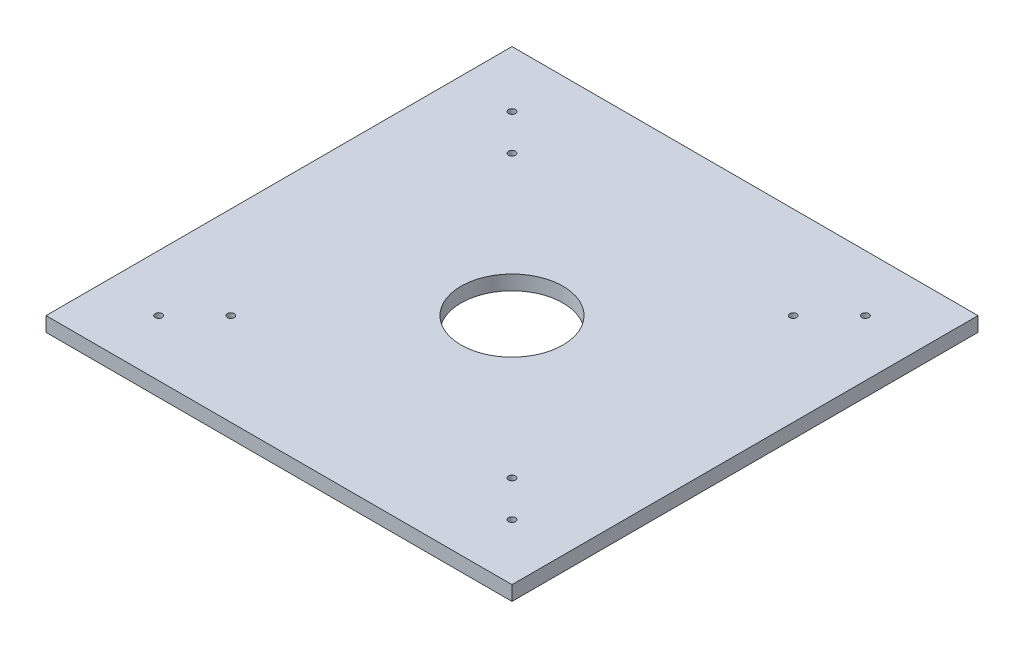
from build123d import *

# Parameters (mm, degrees)
SKETCH1_W           = 160
SKETCH1_H           = 160
SKETCH1_R           = 1.2
SKETCH1_R_2         = 17.5
BOSS_EXTRUDE1_DEPTH = 5


with BuildPart() as part:
    # Sketch1 → Boss-Extrude1 (new body)
    with BuildSketch(Plane(origin=(0, 0, 0), x_dir=(1, 0, 0), z_dir=(0, 1, 0))):
        Rectangle(SKETCH1_W, SKETCH1_H)
        with Locations(Location((-60.664206642, 60.664206642, 0), (0, 0, 270))):
            Circle(SKETCH1_R, mode=Mode.SUBTRACT)
        with Locations(Location((-48.279552135, 48.279552135, 0), (0, 0, 270))):
            Circle(SKETCH1_R, mode=Mode.SUBTRACT)
        with Locations(Location((48.279552135, 48.279552135, 0), (0, 0, 90))):
            Circle(SKETCH1_R, mode=Mode.SUBTRACT)
        with Locations(Location((60.664206642, 60.664206642, 0), (0, 0, 90))):
            Circle(SKETCH1_R, mode=Mode.SUBTRACT)
        with Locations(Location((60.664206642, -60.664206642, 0), (0, 0, 270))):
            Circle(SKETCH1_R, mode=Mode.SUBTRACT)
        with Locations(Location((48.279552135, -48.279552135, 0), (0, 0, 270))):
            Circle(SKETCH1_R, mode=Mode.SUBTRACT)
        with Locations(Location((-48.279552135, -48.279552135, 0), (0, 0, 90))):
            Circle(SKETCH1_R, mode=Mode.SUBTRACT)
        with Locations(Location((-60.664206642, -60.664206642, 0), (0, 0, 90))):
            Circle(SKETCH1_R, mode=Mode.SUBTRACT)
        with Locations(Location((0, 0, 0), (0, 0, 270))):
            Circle(SKETCH1_R_2, mode=Mode.SUBTRACT)
    extrude(amount=BOSS_EXTRUDE1_DEPTH)


solid = part.part
